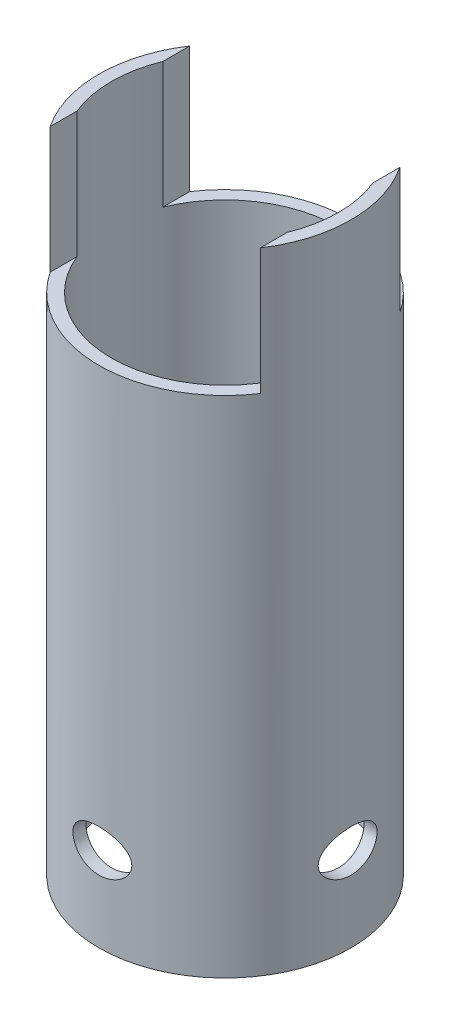
from build123d import *

# Parameters (mm, degrees)
SKETCH2_R               = 15
SKETCH2_R_2             = 13.5
BOSS_EXTRUDE2_DEPTH     = 75
CUT_EXTRUDE1_DEPTH      = 78.942286341
CUT_EXTRUDE1_DEPTH_BACK = 78.942286341
SKETCH4_RX              = 3.5
SKETCH4_RY              = 2.5
CUT_EXTRUDE2_DEPTH      = 78.942286475
CUT_EXTRUDE2_DEPTH_BACK = 78.942286475
SKETCH5_RX              = 3.5
SKETCH5_RY              = 2.5
CUT_EXTRUDE3_DEPTH      = 78.942286475
CUT_EXTRUDE3_DEPTH_BACK = 78.942286475
SKETCH6_W               = 25
SKETCH6_H               = 15


with BuildPart() as part:
    # Sketch2 → Boss-Extrude2 (new body)
    with BuildSketch(Plane(origin=(0, 0, 0), x_dir=(1, 0, 0), z_dir=(0, 1, 0))):
        with Locations(Location((0, 0, 0), (0, 0, 270))):
            Circle(SKETCH2_R)
        with Locations(Location((0, 0, 0), (0, 0, 270))):
            Circle(SKETCH2_R_2, mode=Mode.SUBTRACT)
    extrude(amount=BOSS_EXTRUDE2_DEPTH)

    # Sketch4 → Cut-Extrude1 (cut, two sides: drawn at the far end of the back side and taken through both)
    with BuildSketch(Plane.XY.offset(-CUT_EXTRUDE1_DEPTH_BACK)):
        with Locations((0, 10)):
            Ellipse(SKETCH4_RX, SKETCH4_RY)
    extrude(amount=CUT_EXTRUDE1_DEPTH + CUT_EXTRUDE1_DEPTH_BACK, mode=Mode.SUBTRACT)

    # Sketch5 → Cut-Extrude2 (cut, two sides: drawn at the far end of the back side and taken through both)
    with BuildSketch(Plane(origin=(0, 0, 0), x_dir=(0, 0, -1), z_dir=(1, 0, 0)).offset(-CUT_EXTRUDE2_DEPTH_BACK)):
        with Locations(Location((0, 10), (0, 0, 180))):
            Ellipse(SKETCH5_RX, SKETCH5_RY)
    extrude(amount=CUT_EXTRUDE2_DEPTH + CUT_EXTRUDE2_DEPTH_BACK, mode=Mode.SUBTRACT)

    # Sketch6 → Cut-Extrude3 (cut, two sides: drawn at the far end of the back side and taken through both)
    with BuildSketch(Plane.XY.offset(-CUT_EXTRUDE3_DEPTH_BACK)):
        with Locations((0, 67.5)):
            Rectangle(SKETCH6_W, SKETCH6_H)
    extrude(amount=CUT_EXTRUDE3_DEPTH + CUT_EXTRUDE3_DEPTH_BACK, mode=Mode.SUBTRACT)


solid = part.part
